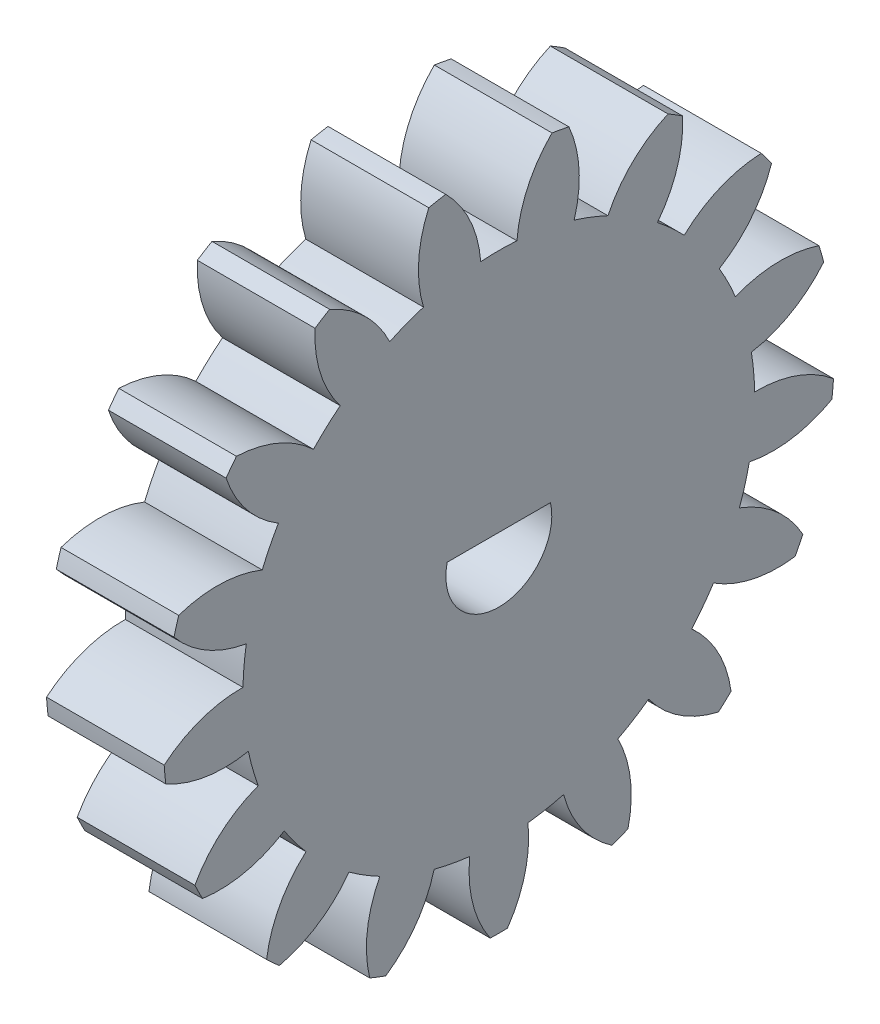
from build123d import *

# Parameters (mm, degrees)
BASPROSKE_W        = 5
BASPROSKE_H        = 14.25
TOOTHCUT_DEPTH     = 21.763549793
TEETHCUTS_COUNT    = 17
TEETHCUTS_ANGLE    = 338.823529412
BORSKE_R           = 0.4
BORE_DEPTH         = 50.0000508
CUT_EXTRUDE1_DEPTH = 21.741790351


with BuildPart() as part:
    # BasProSke → Base-Revolve (revolve)
    with BuildSketch(Plane(origin=(0, 0, 0), x_dir=(1, 0, 0), z_dir=(0, 1, 0)), mode=Mode.PRIVATE) as base_revolve_sk:
        with Locations((2.5, 7.125)):
            Rectangle(BASPROSKE_W, BASPROSKE_H)
    revolve(base_revolve_sk.sketch.rotate(Axis((-10, 0, 0), (1, 0, 0)), 180), axis=Axis((-10, 0, 0), (1, 0, 0)))

    # TooCutSke → ToothCut (cut, through all)
    with BuildSketch(Plane(origin=(0, 0, 0), x_dir=(0, 0, -1), z_dir=(1, 0, 0))):
        with BuildLine():
            ThreePointArc((0.769354207, 10.846749287), (0, 10.874), (-0.769354207, 10.846749287))
            ThreePointArc((-0.769354207, 10.846749287), (-1.230849554, 12.606357238), (-2.280560064, 14.092057726))
            ThreePointArc((-2.280560064, 14.092057726), (0, 14.2754), (2.280560064, 14.092057726))
            ThreePointArc((2.280560064, 14.092057726), (1.230849554, 12.606357238), (0.769354207, 10.846749287))
        make_face()
    toothcut = extrude(amount=TOOTHCUT_DEPTH, mode=Mode.SUBTRACT)

    # TeethCuts: ToothCut ×17 about axis
    teethcuts_axis = Axis((-10, 0, 0), (1, 0, 0))
    for i in range(1, TEETHCUTS_COUNT):
        add(toothcut.rotate(teethcuts_axis, i * TEETHCUTS_ANGLE / (TEETHCUTS_COUNT - 1)), mode=Mode.SUBTRACT)

    # BorSke → Bore (cut, symmetric)
    with BuildSketch(Plane(origin=(0, 0, 0), x_dir=(0, 0, -1), z_dir=(1, 0, 0))):
        with Locations(Location((0, 0, 0), (0, 0, 180))):
            Circle(BORSKE_R)
    extrude(amount=BORE_DEPTH, both=True, mode=Mode.SUBTRACT)

    # Sketch1 → Cut-Extrude1 (cut, through all)
    with BuildSketch(Plane(origin=(5, 0, 0), x_dir=(0, 0, -1), z_dir=(1, 0, 0))):
        with BuildLine():
            Line((-2.193741097, 0.5), (2.193741097, 0.5))
            ThreePointArc((2.193741097, 0.5), (0, -2.25), (-2.193741097, 0.5))
        make_face()
    extrude(amount=-CUT_EXTRUDE1_DEPTH, mode=Mode.SUBTRACT)


solid = part.part
